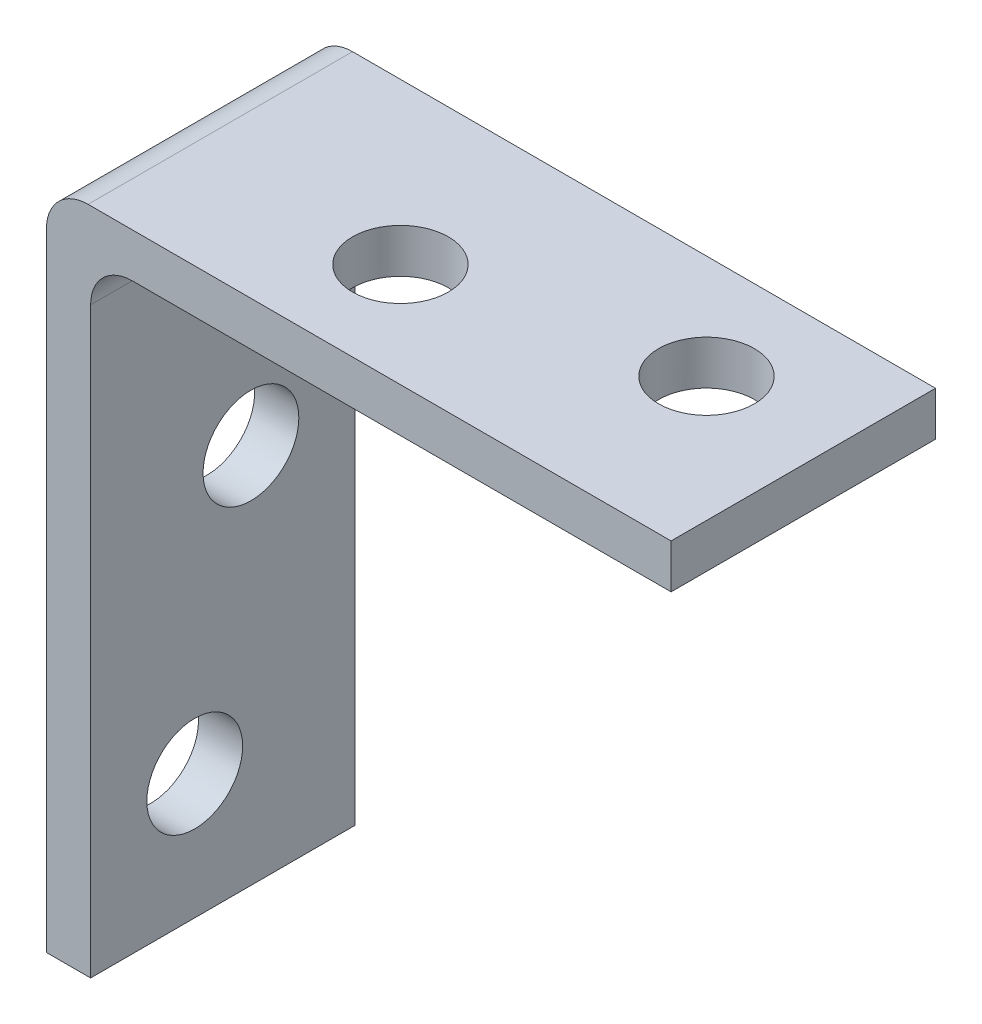
from build123d import *

# Parameters (mm, degrees)
BOSS_EXTRUDE1_DEPTH      = 8.0645
BOSS_EXTRUDE1_DEPTH_BACK = 8.0645
CUT_EXTRUDE1_REACH       = 58.397
SKETCH2_R                = 2.921
CUT_EXTRUDE2_REACH       = 56.482
SKETCH5_R                = 2.921
FILLET1_R                = 2.54


with BuildPart() as part:
    # Sketch1 → Boss-Extrude1 (new, two sides: drawn at the far end of the back side and taken through both)
    with BuildSketch(Plane.XY.offset(-BOSS_EXTRUDE1_DEPTH_BACK)):
        Polygon((0, 0), (2.6924, 0), (2.6924, 38.1), (38.1, 38.1), (38.1, 40.7924), (0, 40.7924), (0, 38.1), align=None)
    extrude(amount=BOSS_EXTRUDE1_DEPTH + BOSS_EXTRUDE1_DEPTH_BACK)

    # Sketch2 → Cut-Extrude1 (cut, up to next)
    with BuildSketch(Plane.ZY, mode=Mode.PRIVATE) as cut_extrude1_sk1:
        with Locations((1.7145, 7.62)):
            Circle(SKETCH2_R)
    cut_extrude1_tool1 = extrude(cut_extrude1_sk1.sketch, amount=-CUT_EXTRUDE1_REACH, mode=Mode.PRIVATE) & part.part
    # Sketch2 → Cut-Extrude1 (cut, up to next)
    with BuildSketch(Plane.ZY, mode=Mode.PRIVATE) as cut_extrude1_sk2:
        with Locations((-1.7145, 23.241)):
            Circle(SKETCH2_R)
    cut_extrude1_tool2 = extrude(cut_extrude1_sk2.sketch, amount=-CUT_EXTRUDE1_REACH, mode=Mode.PRIVATE) & part.part
    add(cut_extrude1_tool1.solids().sort_by_distance((0, 7.62, 1.7145))[0], mode=Mode.SUBTRACT)
    add(cut_extrude1_tool2.solids().sort_by_distance((0, 23.241, -1.7145))[0], mode=Mode.SUBTRACT)

    # Sketch5 → Cut-Extrude2 (cut, up to next)
    with BuildSketch(Plane.XZ.offset(-38.1), mode=Mode.PRIVATE) as cut_extrude2_sk1:
        with Locations((30.48, -1.7145)):
            Circle(SKETCH5_R)
    cut_extrude2_tool1 = extrude(cut_extrude2_sk1.sketch, amount=-CUT_EXTRUDE2_REACH, mode=Mode.PRIVATE) & part.part
    # Sketch5 → Cut-Extrude2 (cut, up to next)
    with BuildSketch(Plane.XZ.offset(-38.1), mode=Mode.PRIVATE) as cut_extrude2_sk2:
        with Locations((15.24, 1.7145)):
            Circle(SKETCH5_R)
    cut_extrude2_tool2 = extrude(cut_extrude2_sk2.sketch, amount=-CUT_EXTRUDE2_REACH, mode=Mode.PRIVATE) & part.part
    add(cut_extrude2_tool1.solids().sort_by_distance((30.48, 38.1, -1.7145))[0], mode=Mode.SUBTRACT)
    add(cut_extrude2_tool2.solids().sort_by_distance((15.24, 38.1, 1.7145))[0], mode=Mode.SUBTRACT)

    # Fillet1
    fillet1_edges = [part.edges().sort_by_distance(p)[0] for p in [
        (0, 40.7924, 0),
        (2.6924, 38.1, 0),
    ]]
    fillet(fillet1_edges, radius=FILLET1_R)


solid = part.part
